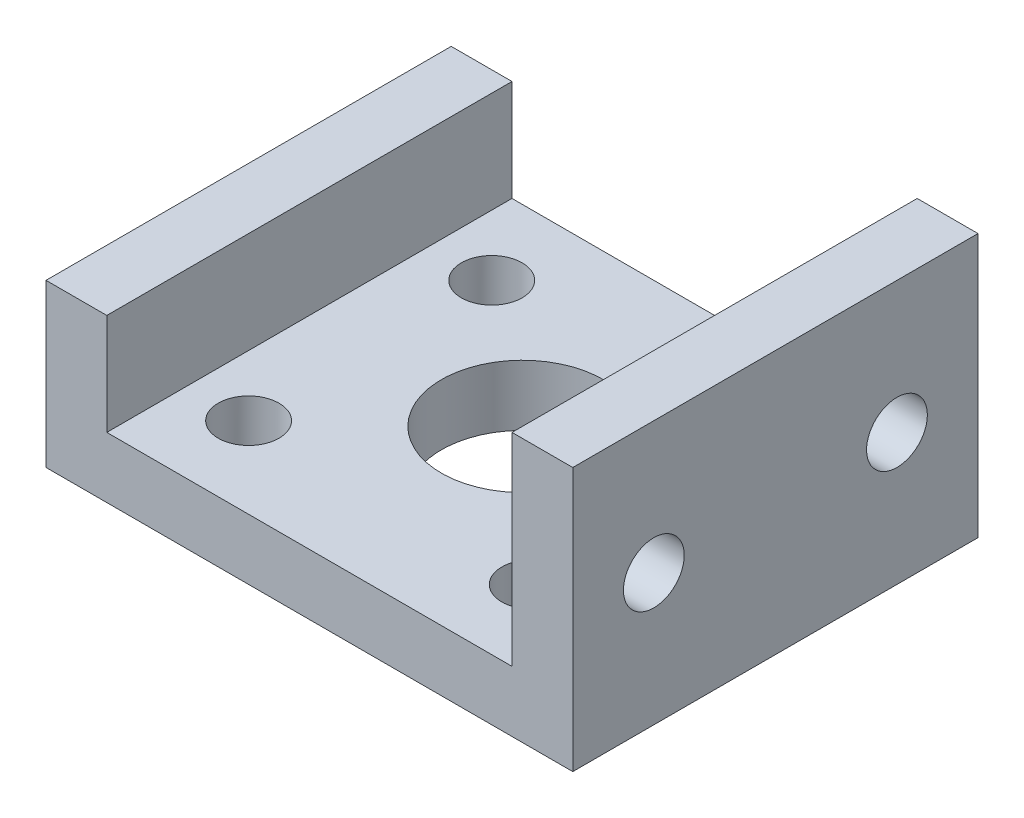
from build123d import *

# Parameters (mm, degrees)
EXTRUDE_1_DEPTH          = 160
CUT_EXTRUDE_2_DEPTH      = 167.400871392
CUT_EXTRUDE_2_DEPTH_BACK = 167.400871392
SKETCH_5_R               = 1.5
CUT_EXTRUDE_3_DEPTH      = 3
SKETCH_6_R               = 1.5
SKETCH_6_R_2             = 4
CUT_EXTRUDE_4_DEPTH      = 3


with BuildPart() as part:
    # 草图1 → 凸台-拉伸1 (new body)
    with BuildSketch(Plane.XY):
        Polygon((-8.639969484, -35.5), (-8.639969484, -39.5), (17.360030516, -39.5), (17.360030516, 39.5), (-8.639969484, 39.5), (-8.639969484, 35.5), (-8.639969484, 31.5), (-5.639969484, 31.5), (-5.639969484, 36.5), (14.360030516, 36.5), (14.360030516, -36.5), (-5.639969484, -36.5), (-5.639969484, -31.5), (-8.639969484, -31.5), align=None)
    extrude(amount=EXTRUDE_1_DEPTH)

    # 草图4 → 切除-拉伸2 (cut, two sides: drawn at the far end of the back side and taken through both)
    with BuildSketch(Plane.ZY.offset(-14.360030516).offset(-CUT_EXTRUDE_2_DEPTH_BACK)):
        Polygon((140, 26.5), (160, 26.5), (160, -26.5), (140, -26.5), (140, -45.304030301), (130, -45.304030301), (130, -26.5), (110, -26.5), (110, -45.304030301), (100, -45.304030301), (100, -26.5), (80, -26.5), (80, -45.304030301), (72.341947093, -45.304030301), (72.341947093, -47.20233834), (-21.576648983, -47.20233834), (-21.576648983, 47.202965292), (72.341947093, 47.202965292), (72.341947093, 45.304030301), (80, 45.304030301), (80, 26.5), (100, 26.5), (100, 45.304030301), (110, 45.304030301), (110, 26.5), (130, 26.5), (130, 45.304030301), (140, 45.304030301), align=None)
    extrude(amount=CUT_EXTRUDE_2_DEPTH + CUT_EXTRUDE_2_DEPTH_BACK, mode=Mode.SUBTRACT)


with BuildPart() as cut_extrude_2_piece_1:
    # of the separate pieces the step leaves, piece 1, a body of its own (cut_extrude_2_pieces)
    add(part.part.solids().sort_by_distance((17.360030516, 39.5, 80))[0])


with BuildPart() as cut_extrude_2_piece_2:
    # of the separate pieces the step leaves, piece 2, a body of its own (cut_extrude_2_pieces)
    add(part.part.solids().sort_by_distance((17.360030516, 39.5, 110))[0])


with BuildPart() as cut_extrude_2_piece_3:
    # of the separate pieces the step leaves, piece 3, a body of its own (cut_extrude_2_pieces)
    add(part.part.solids().sort_by_distance((17.360030516, -39.5, 140))[0])


with BuildPart() as cut_extrude_2_piece_4:
    # of the separate pieces the step leaves, piece 4, a body of its own (cut_extrude_2_pieces)
    add(part.part.solids().sort_by_distance((17.360030516, 39.5, 140))[0])


with BuildPart() as cut_extrude_2_piece_5:
    # of the separate pieces the step leaves, piece 5, a body of its own (cut_extrude_2_pieces)
    add(part.part.solids().sort_by_distance((17.360030516, -39.5, 110))[0])


with BuildPart() as cut_extrude_2_piece_6:
    # of the separate pieces the step leaves, piece 6, a body of its own (cut_extrude_2_pieces)
    add(part.part.solids().sort_by_distance((-8.639969484, -39.5, 80))[0])


with BuildPart() as cut_extrude_3_tool:
    # 草图5 → 切除-拉伸3 (new body)
    with BuildSketch(Plane(origin=(17.360030516, 0, 0), x_dir=(0, 0, -1), z_dir=(1, 0, 0))):
        with Locations(Location((-96, -33, 0), (0, 0, 90))):
            Circle(SKETCH_5_R)
        with Locations(Location((-84, -33, 0), (0, 0, 90))):
            Circle(SKETCH_5_R)
        with Locations(Location((-126, -33, 0), (0, 0, 90))):
            Circle(SKETCH_5_R)
        with Locations(Location((-114, -33, 0), (0, 0, 90))):
            Circle(SKETCH_5_R)
        with Locations(Location((-156, -33, 0), (0, 0, 90))):
            Circle(SKETCH_5_R)
        with Locations(Location((-144, -33, 0), (0, 0, 90))):
            Circle(SKETCH_5_R)
        with Locations((-84, 33)):
            Circle(SKETCH_5_R)
        with Locations((-96, 33)):
            Circle(SKETCH_5_R)
        with Locations((-114, 33)):
            Circle(SKETCH_5_R)
        with Locations((-126, 33)):
            Circle(SKETCH_5_R)
        with Locations((-144, 33)):
            Circle(SKETCH_5_R)
        with Locations((-156, 33)):
            Circle(SKETCH_5_R)
    extrude(amount=-CUT_EXTRUDE_3_DEPTH)


with BuildPart() as cut_extrude_2_piece_1_1:
    add(cut_extrude_2_piece_1.part)

    # 切除-拉伸3: cut by cut_extrude_3_tool
    add(cut_extrude_3_tool.part, mode=Mode.SUBTRACT)


with BuildPart() as cut_extrude_2_piece_2_1:
    add(cut_extrude_2_piece_2.part)

    # 切除-拉伸3: cut by cut_extrude_3_tool
    add(cut_extrude_3_tool.part, mode=Mode.SUBTRACT)


with BuildPart() as cut_extrude_2_piece_3_1:
    add(cut_extrude_2_piece_3.part)

    # 切除-拉伸3: cut by cut_extrude_3_tool
    add(cut_extrude_3_tool.part, mode=Mode.SUBTRACT)


with BuildPart() as cut_extrude_2_piece_4_1:
    add(cut_extrude_2_piece_4.part)

    # 切除-拉伸3: cut by cut_extrude_3_tool
    add(cut_extrude_3_tool.part, mode=Mode.SUBTRACT)


with BuildPart() as cut_extrude_2_piece_5_1:
    add(cut_extrude_2_piece_5.part)

    # 切除-拉伸3: cut by cut_extrude_3_tool
    add(cut_extrude_3_tool.part, mode=Mode.SUBTRACT)


with BuildPart() as cut_extrude_2_piece_6_1:
    add(cut_extrude_2_piece_6.part)

    # 切除-拉伸3: cut by cut_extrude_3_tool
    add(cut_extrude_3_tool.part, mode=Mode.SUBTRACT)


with BuildPart() as cut_extrude_4_tool:
    # 草图6 → 切除-拉伸4 (new body)
    with BuildSketch(Plane.XZ.offset(39.5)):
        with Locations((11.360030516, 96)):
            Circle(SKETCH_6_R)
        with Locations((11.360030516, 84)):
            Circle(SKETCH_6_R)
        with Locations((-2.639969484, 84)):
            Circle(SKETCH_6_R)
        with Locations((-2.639969484, 96)):
            Circle(SKETCH_6_R)
        with Locations((-2.639969484, 126)):
            Circle(SKETCH_6_R)
        with Locations((-2.639969484, 114)):
            Circle(SKETCH_6_R)
        with Locations((11.360030516, 114)):
            Circle(SKETCH_6_R)
        with Locations((11.360030516, 126)):
            Circle(SKETCH_6_R)
        with Locations((-2.639969484, 156)):
            Circle(SKETCH_6_R)
        with Locations((-2.639969484, 144)):
            Circle(SKETCH_6_R)
        with Locations((11.360030516, 144)):
            Circle(SKETCH_6_R)
        with Locations((11.360030516, 156)):
            Circle(SKETCH_6_R)
        with Locations((4.360030516, 89.485879771)):
            Circle(SKETCH_6_R_2)
        with Locations((4.360030516, 119.485879771)):
            Circle(SKETCH_6_R_2)
        with Locations((4.360030516, 149.485879771)):
            Circle(SKETCH_6_R_2)
    cut_extrude_4 = extrude(amount=-CUT_EXTRUDE_4_DEPTH)


with BuildPart() as cut_extrude_2_piece_3_2:
    add(cut_extrude_2_piece_3_1.part)

    # 切除-拉伸4: cut by cut_extrude_4_tool
    add(cut_extrude_4_tool.part, mode=Mode.SUBTRACT)


with BuildPart() as cut_extrude_2_piece_5_2:
    add(cut_extrude_2_piece_5_1.part)

    # 切除-拉伸4: cut by cut_extrude_4_tool
    add(cut_extrude_4_tool.part, mode=Mode.SUBTRACT)


with BuildPart() as cut_extrude_2_piece_6_2:
    add(cut_extrude_2_piece_6_1.part)

    # 切除-拉伸4: cut by cut_extrude_4_tool
    add(cut_extrude_4_tool.part, mode=Mode.SUBTRACT)


with BuildPart() as mirror_1_tool:
    # 镜向1: 切除-拉伸4 across plane
    add(cut_extrude_4.mirror(Plane.ZX))


with BuildPart() as cut_extrude_2_piece_1_2:
    add(cut_extrude_2_piece_1_1.part)

    # 镜向1: cut by mirror_1_tool
    add(mirror_1_tool.part, mode=Mode.SUBTRACT)


with BuildPart() as cut_extrude_2_piece_2_2:
    add(cut_extrude_2_piece_2_1.part)

    # 镜向1: cut by mirror_1_tool
    add(mirror_1_tool.part, mode=Mode.SUBTRACT)


with BuildPart() as cut_extrude_2_piece_4_2:
    add(cut_extrude_2_piece_4_1.part)

    # 镜向1: cut by mirror_1_tool
    add(mirror_1_tool.part, mode=Mode.SUBTRACT)


solid = cut_extrude_2_piece_3_2.part
